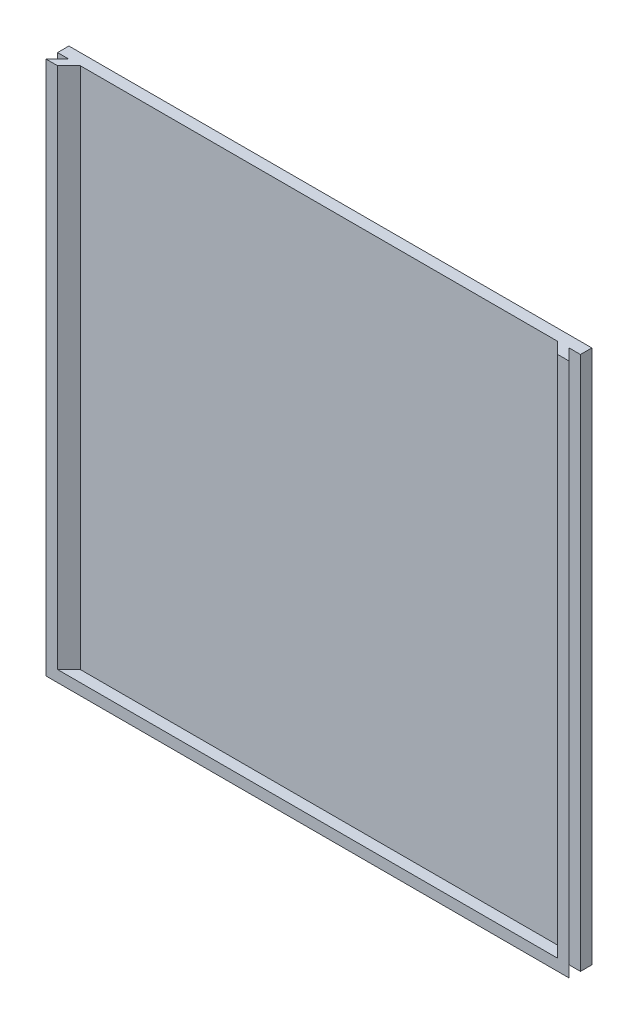
from build123d import *

# Parameters (mm, degrees)
EXTRUDE_1_DEPTH = 47
EXTRUDE_3_DEPTH = 1


with BuildPart() as part:
    # 草图1 → 凸台-拉伸1 (new body)
    with BuildSketch(Plane(origin=(0, 0, 0), x_dir=(1, 0, 0), z_dir=(0, 1, 0))):
        Polygon((-23, 2.1), (23, 2.1), (23, 1.1), (22, 1.1), (23, 0.1), (22, 0.1), (21, 1.1), (-21, 1.1), (-22, 0.1), (-23, 0.1), (-22, 1.1), (-23, 1.1), align=None)
    extrude(amount=EXTRUDE_1_DEPTH)

    # 草图2 → 凸台-拉伸3 (add)
    with BuildSketch(Plane.XZ):
        Polygon((22, -0.1), (-22, -0.1), (-21, -1.1), (21, -1.1), align=None)
    extrude(amount=-EXTRUDE_3_DEPTH)


solid = part.part
